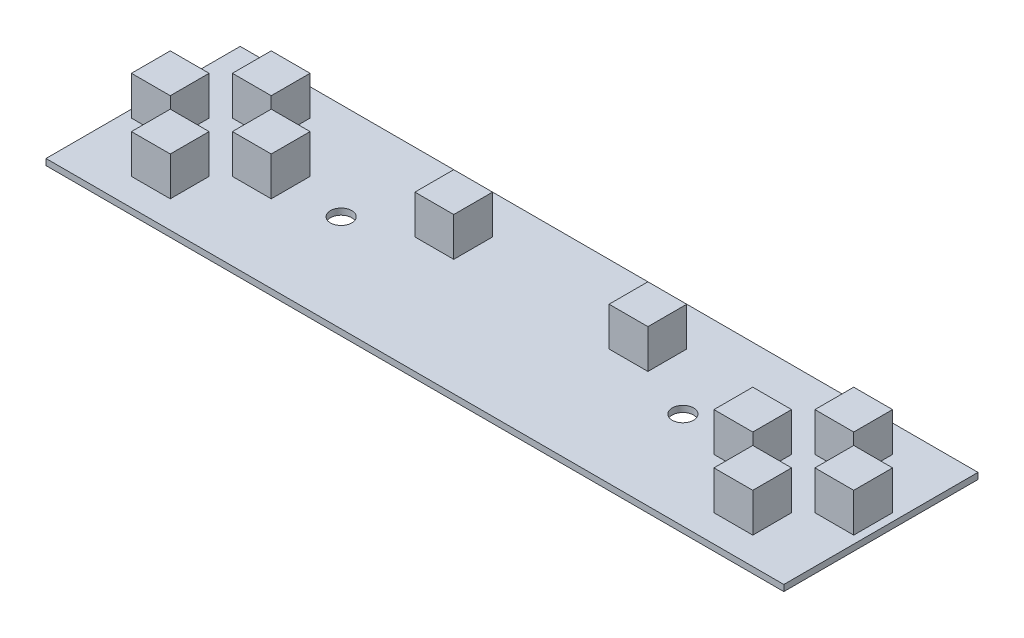
from build123d import *

# Parameters (mm, degrees)
SKETCH1_W            = 190
SKETCH1_H            = 50
BOSS_EXTRUDE1_DEPTH  = 0.8
SKETCH2_W            = 10
SKETCH2_H            = 10
BOSS_EXTRUDE2_DEPTH  = 10
M5_CLEARANCE_HOLE1_D = 5.5


with BuildPart() as part:
    # Sketch1 → Boss-Extrude1 (new, symmetric)
    with BuildSketch(Plane(origin=(0, 0, 0), x_dir=(1, 0, 0), z_dir=(0, 1, 0))):
        Rectangle(SKETCH1_W, SKETCH1_H)
    extrude(amount=BOSS_EXTRUDE1_DEPTH, both=True)

    # Sketch2 → Boss-Extrude2 (add)
    with BuildSketch(Plane(origin=(0, 0.8, 0), x_dir=(1, 0, 0), z_dir=(0, 1, 0))):
        with Locations((-62, 0)):
            Rectangle(SKETCH2_W, SKETCH2_H)
        with Locations((-75, 13)):
            Rectangle(SKETCH2_W, SKETCH2_H)
        with Locations((-75, -13)):
            Rectangle(SKETCH2_W, SKETCH2_H)
        with Locations((-88, 0)):
            Rectangle(SKETCH2_W, SKETCH2_H)
        with Locations((-25, 10)):
            Rectangle(SKETCH2_W, SKETCH2_H)
        with Locations((25, 10)):
            Rectangle(SKETCH2_W, SKETCH2_H)
        with Locations((88, 0)):
            Rectangle(SKETCH2_W, SKETCH2_H)
        with Locations((75, -13)):
            Rectangle(SKETCH2_W, SKETCH2_H)
        with Locations((62, 0)):
            Rectangle(SKETCH2_W, SKETCH2_H)
        with Locations((75, 13)):
            Rectangle(SKETCH2_W, SKETCH2_H)
    extrude(amount=BOSS_EXTRUDE2_DEPTH)

    # M5 Clearance Hole1 (through all)
    with Locations(Plane(origin=(0, 10.8, 0), x_dir=(1, 0, 0), z_dir=(0, 1, 0))):
        with Locations((-44, 0), (44, 0)):
            Hole(M5_CLEARANCE_HOLE1_D / 2)


solid = part.part
